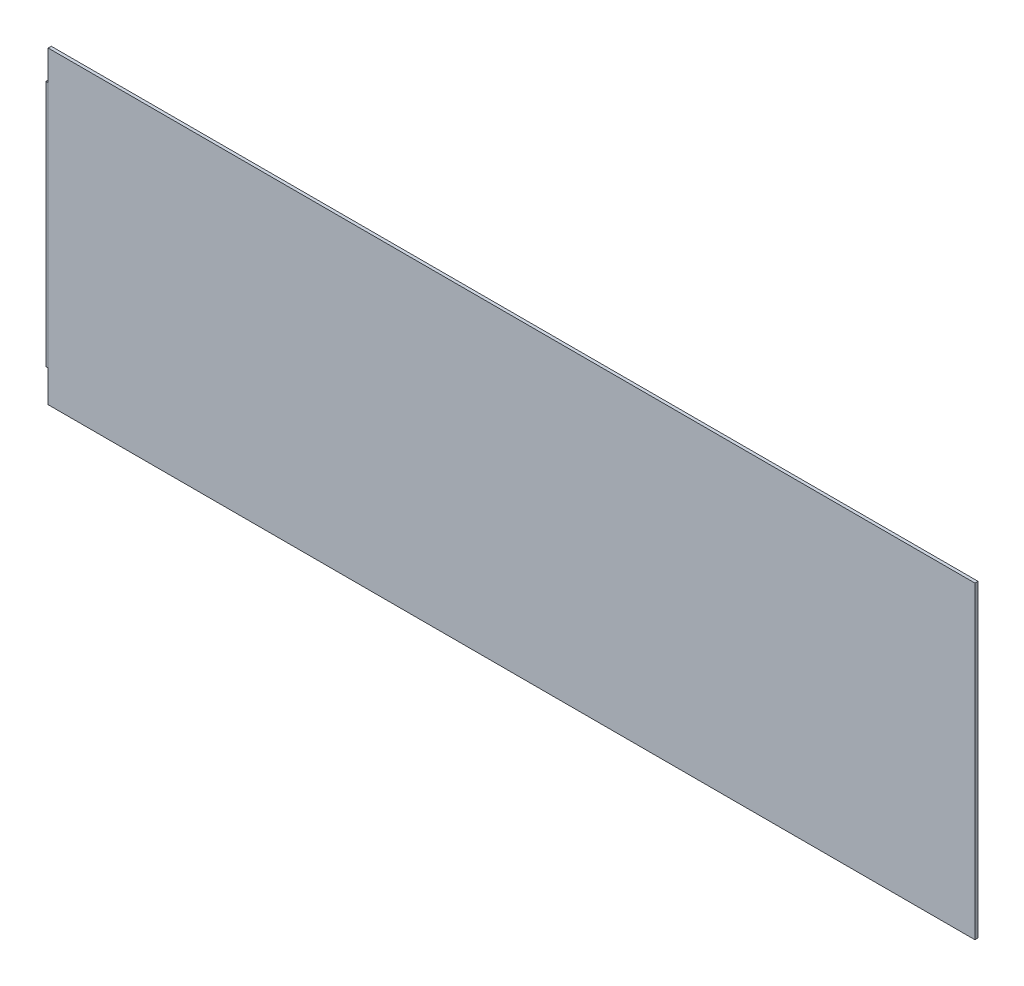
from build123d import *

# Parameters (mm, degrees)
SCHIZZO1_W                   = 1500
SCHIZZO1_H                   = 500
ESTRUSIONE_ESTRUSIONE1_DEPTH = 5
SCHIZZO2_W                   = 2
SCHIZZO2_H                   = 400
ESTRUSIONE_ESTRUSIONE2_DEPTH = 5


with BuildPart() as part:
    # Schizzo1 → Estrusione-Estrusione1 (new body)
    with BuildSketch(Plane.XY):
        Rectangle(SCHIZZO1_W, SCHIZZO1_H)
    extrude(amount=ESTRUSIONE_ESTRUSIONE1_DEPTH)

    # Schizzo2 → Estrusione-Estrusione2 (add)
    with BuildSketch(Plane.ZY.offset(750)):
        with Locations((2.5, 0)):
            Rectangle(SCHIZZO2_W, SCHIZZO2_H)
    extrude(amount=ESTRUSIONE_ESTRUSIONE2_DEPTH)


solid = part.part
